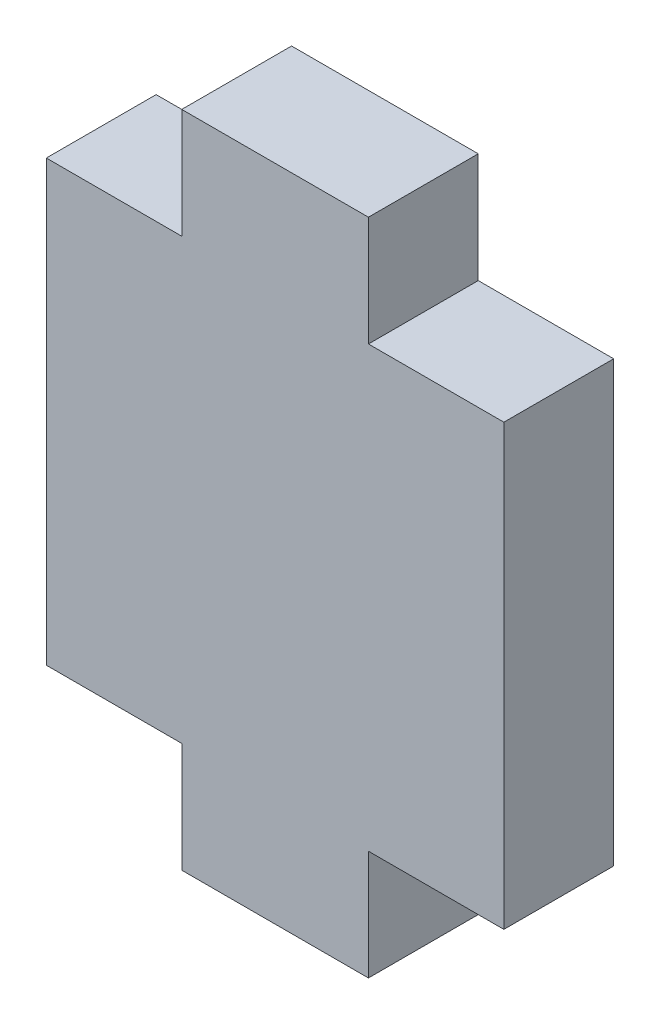
from build123d import *

# Parameters (mm, degrees)
BOSS_EXTRU_1_DEPTH = 6


with BuildPart() as part:
    # Esquisse1 → Boss.-Extru.1 (new body)
    with BuildSketch(Plane.XY):
        Polygon((0, 0), (0, 6), (-7.4, 6), (-7.4, 30), (0, 30), (0, 36), (10.2, 36), (10.2, 30), (17.6, 30), (17.6, 6), (10.2, 6), (10.2, 0), align=None)
    extrude(amount=BOSS_EXTRU_1_DEPTH)


solid = part.part
